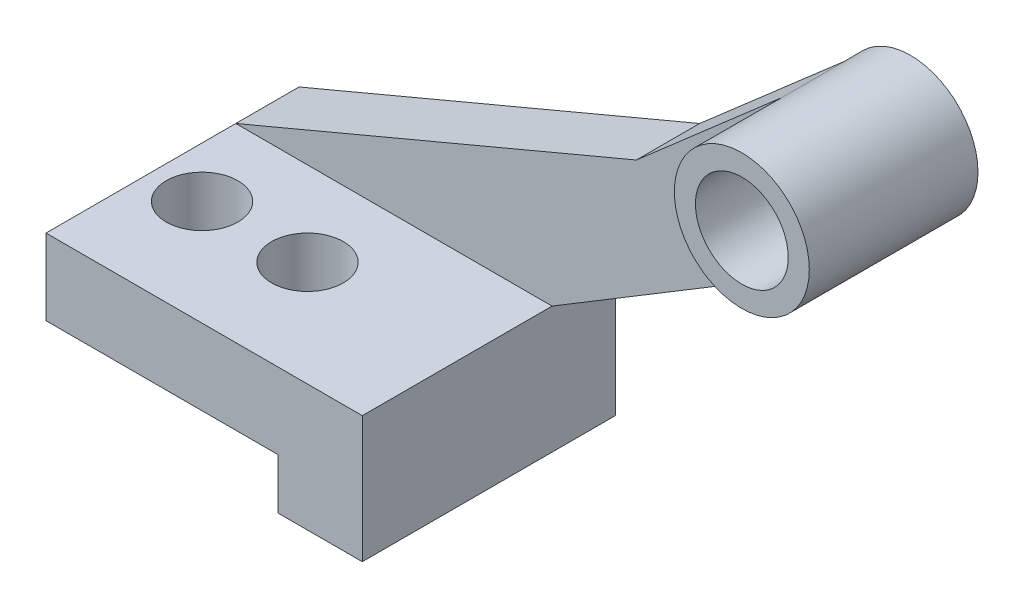
from build123d import *

# Parameters (mm, degrees)
BOSS_EXTRUDE1_DEPTH      = 60
BOSS_EXTRUDE2_DEPTH      = 15
BOSS_EXTRUDE3_DEPTH      = 35
BOSS_EXTRUDE3_DEPTH_BACK = 5
SKETCH1_4_R              = 11
SKETCH2_R                = 8.5
CUT_EXTRUDE1_DEPTH       = 35


with BuildPart() as part:
    # Sketch1 → Boss-Extrude1 (new body)
    with BuildSketch(Plane.XY):
        Polygon((-62.731983875, -18.108440156), (-62.731983875, -36.108440156), (-7.731983875, -36.108440156), (-7.731983875, -48.108440156), (12.268016125, -48.108440156), (12.268016125, -18.108440156), align=None)
    extrude(amount=BOSS_EXTRUDE1_DEPTH)

    # Sketch1<3> → Boss-Extrude2 (add)
    with BuildSketch(Plane.XY):
        with BuildLine():
            Line((32.268016125, 21.891559844), (-62.731983875, -18.108440156))
            Line((-62.731983875, -18.108440156), (12.268016125, -18.108440156))
            Line((12.268016125, -18.108440156), (85.546754882, 26.199861359))
            ThreePointArc((85.546754882, 26.199861359), (64.34324961, 30.460215847), (66.754706964, 51.95263613))
            Line((66.754706964, 51.95263613), (32.268016125, 21.891559844))
        make_face()
    extrude(amount=BOSS_EXTRUDE2_DEPTH)

    # Sketch1<4> → Boss-Extrude3 (add, two sides: drawn at the far end of the back side and taken through both)
    with BuildSketch(Plane.XY.offset(-BOSS_EXTRUDE3_DEPTH_BACK)):
        with BuildLine():
            ThreePointArc((66.754706964, 51.95263613), (64.34324961, 30.460215847), (85.546754882, 26.199861359))
            ThreePointArc((85.546754882, 26.199861359), (91.204650285, 32.032156327), (93.268009306, 39.891545268))
            ThreePointArc((93.268009306, 39.891545268), (83.89322803, 54.455414207), (66.754706964, 51.95263613))
        make_face()
        with Locations((77.268019887, 39.891545268)):
            Circle(SKETCH1_4_R, mode=Mode.SUBTRACT)
    extrude(amount=BOSS_EXTRUDE3_DEPTH + BOSS_EXTRUDE3_DEPTH_BACK)

    # Sketch2 → Cut-Extrude1 (cut)
    with BuildSketch(Plane(origin=(0, -18.108440156, 0), x_dir=(1, 0, 0), z_dir=(0, 1, 0))):
        with Locations((-50.731983875, -35)):
            Circle(SKETCH2_R)
        with Locations((-25.731983875, -35)):
            Circle(SKETCH2_R)
    extrude(amount=-CUT_EXTRUDE1_DEPTH, mode=Mode.SUBTRACT)


solid = part.part
